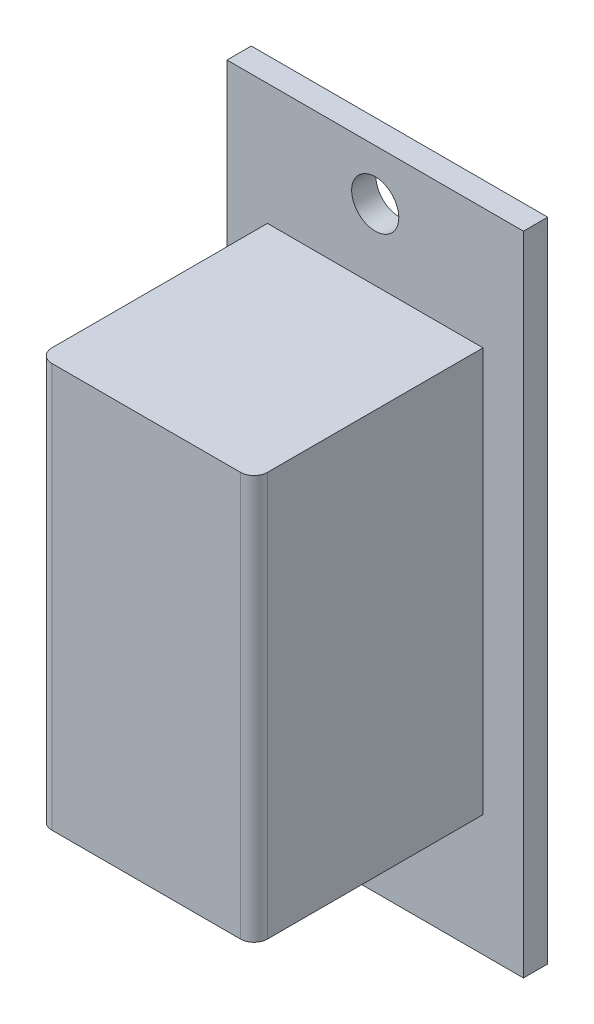
from build123d import *

# Parameters (mm, degrees)
SKETCH_1_W      = 22
SKETCH_1_H      = 48
SKETCH_1_R      = 1.75
EXTRUDE_1_DEPTH = 1.8
SKETCH_2_W      = 16
SKETCH_2_H      = 30
EXTRUDE_2_DEPTH = 17
FILLET_1_R      = 1


with BuildPart() as part:
    # 草图1 → 拉伸1 (new body)
    with BuildSketch(Plane.XY):
        Rectangle(SKETCH_1_W, SKETCH_1_H)
        with Locations((0, 20.25)):
            Circle(SKETCH_1_R, mode=Mode.SUBTRACT)
        with Locations(Location((0, -20.25, 0), (0, 0, 180))):
            Circle(SKETCH_1_R, mode=Mode.SUBTRACT)
    extrude(amount=EXTRUDE_1_DEPTH)

    # 草图2 → 拉伸2 (add)
    with BuildSketch(Plane.XY.offset(1.8)):
        Rectangle(SKETCH_2_W, SKETCH_2_H)
    extrude(amount=EXTRUDE_2_DEPTH)

    # 圆角1
    fillet_1_edges = [part.edges().sort_by_distance(p)[0] for p in [
        (-8, 0, 18.8),
        (8, 0, 18.8),
    ]]
    fillet(fillet_1_edges, radius=FILLET_1_R)


solid = part.part
